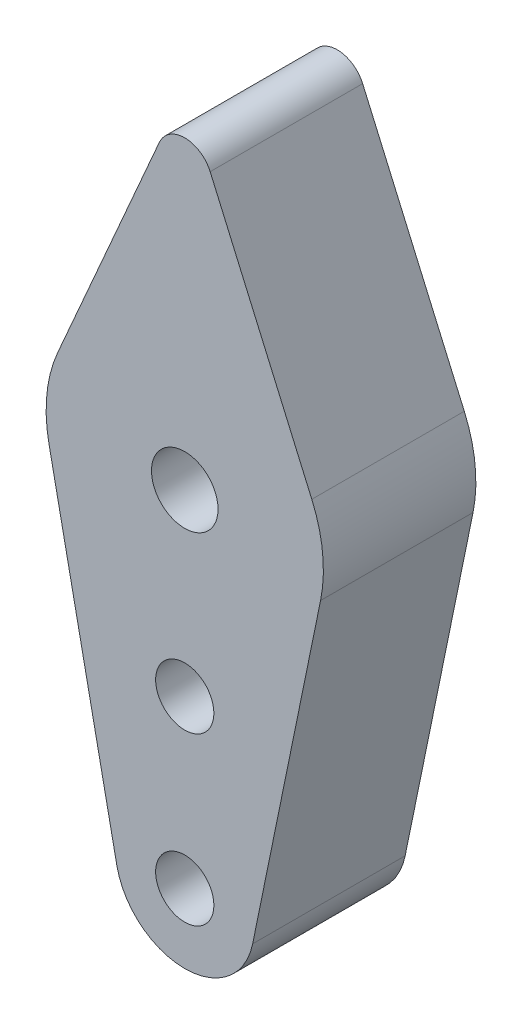
from build123d import *

# Parameters (mm, degrees)
SKETCH_1_R      = 1.05
SKETCH_1_R_2    = 1.2
EXTRUDE_1_DEPTH = 5.5


with BuildPart() as part:
    # ｽｹｯﾁ1 → ﾎﾞｽ - 押し出し1 (new body)
    with BuildSketch(Plane.XY):
        with BuildLine():
            Line((-4.582575695, 2), (-0.916515139, 10.4))
            ThreePointArc((-0.916515139, 10.4), (0, 11), (0.916515139, 10.4))
            Line((0.916515139, 10.4), (4.582575695, 2))
            ThreePointArc((4.582575695, 2), (4.972635715, 0.522392618), (4.898157995, -1.004016064))
            Line((4.898157995, -1.004016064), (2.449078997, -12.952008032))
            ThreePointArc((2.449078997, -12.952008032), (0, -14.95), (-2.449078997, -12.952008032))
            Line((-2.449078997, -12.952008032), (-4.898157995, -1.004016064))
            ThreePointArc((-4.898157995, -1.004016064), (-4.972635715, 0.522392618), (-4.582575695, 2))
        make_face()
        with Locations((0, -6.45)):
            Circle(SKETCH_1_R, mode=Mode.SUBTRACT)
        with Locations((0, -12.45)):
            Circle(SKETCH_1_R, mode=Mode.SUBTRACT)
        Circle(SKETCH_1_R_2, mode=Mode.SUBTRACT)
    extrude(amount=EXTRUDE_1_DEPTH)


solid = part.part
